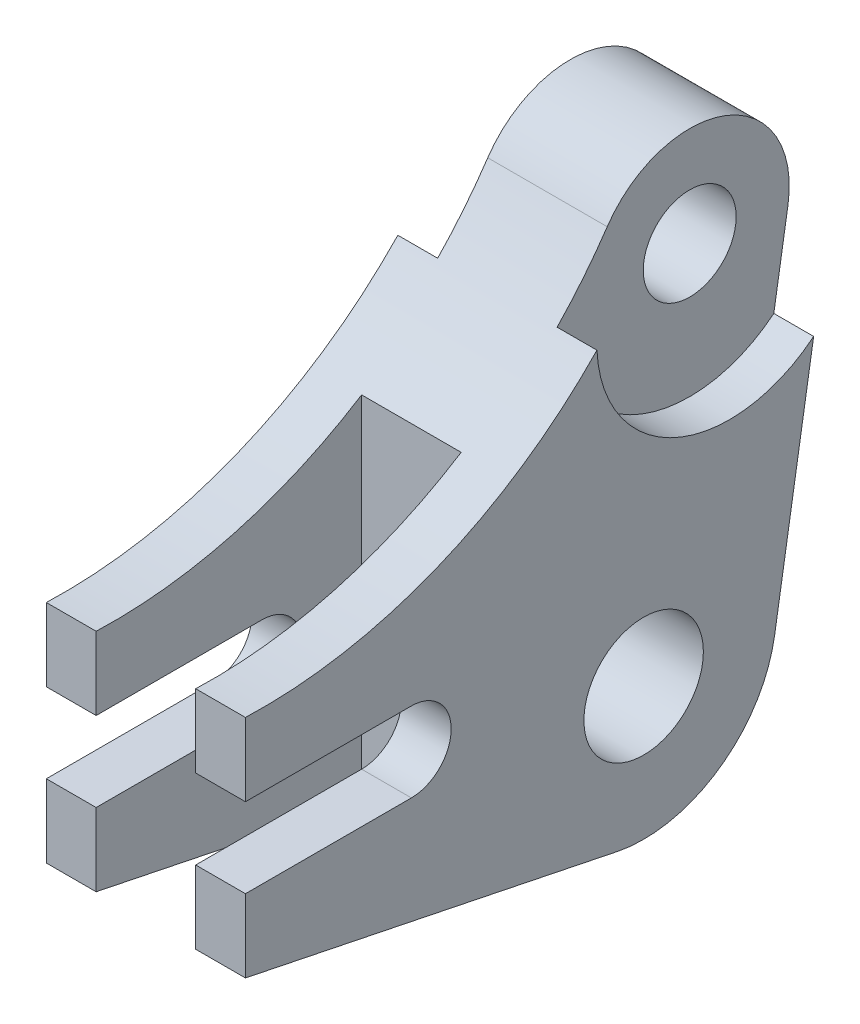
from build123d import *

# Parameters (mm, degrees)
IZIM2_R                     = 7
IZIM2_R_2                   = 9
Y_KSEKLIK_EKSTR_ZYON1_DEPTH = 15
IZIM3_R                     = 20
KES_EKSTR_ZYON1_DEPTH       = 6
KES_EKSTR_ZYON4_DEPTH       = 18
KES_EKSTR_ZYON4_DEPTH_BACK  = 77.999207989
IZIM5_W                     = 15
IZIM5_H                     = 40


with BuildPart() as part:
    # Çizim2 → Yükseklik-Ekstrüzyon1 (new, symmetric)
    with BuildSketch(Plane(origin=(0, 0, 0), x_dir=(0, 0, -1), z_dir=(1, 0, 0))):
        with BuildLine():
            Line((19.739319337, -3.218582315), (27.745441758, 45.882354578))
            ThreePointArc((27.745441758, 45.882354578), (18.474216993, 62.238421042), (0.510195975, 56.691307592))
            ThreePointArc((0.510195975, 56.691307592), (-25.763963339, 33.475550855), (-60, 25.912707322))
            Line((-60, 25.912707322), (-60, 14.912707322))
            Line((-60, 14.912707322), (-35, 14.912707322))
            ThreePointArc((-35, 14.912707322), (-29, 8.912707322), (-35, 2.912707322))
            Line((-35, 2.912707322), (-60, 2.912707322))
            Line((-60, 2.912707322), (-60, -8.087292678))
            Line((-60, -8.087292678), (-4.01109025, -19.593650885))
            ThreePointArc((-4.01109025, -19.593650885), (11.352533428, -16.465721508), (19.739319337, -3.218582315))
        make_face()
        with Locations((12.940952255, 48.296291314)):
            Circle(IZIM2_R, mode=Mode.SUBTRACT)
        Circle(IZIM2_R_2, mode=Mode.SUBTRACT)
    extrude(amount=Y_KSEKLIK_EKSTR_ZYON1_DEPTH, both=True)

    # Çizim3 → Kes-Ekstrüzyon1 (cut)
    with BuildSketch(Plane(origin=(15, 0, 0), x_dir=(0, 0, -1), z_dir=(1, 0, 0))):
        with Locations((12.940952255, 48.296291314)):
            Circle(IZIM3_R)
    kes_ekstr_zyon1 = extrude(amount=-KES_EKSTR_ZYON1_DEPTH, mode=Mode.SUBTRACT)

    # Aynalama1: Kes-Ekstrüzyon1 across plane
    add(kes_ekstr_zyon1.mirror(Plane(origin=(0, 0, 0), x_dir=(0, 0, 1), z_dir=(1, 0, 0))), mode=Mode.SUBTRACT)

    # Çizim5 → Kes-Ekstrüzyon4 (cut, two sides: drawn at the far end of the back side and taken through both)
    with BuildSketch(Plane(origin=(0, 25.86805022, 0), x_dir=(1, 0, 0), z_dir=(0, 1, 0)).offset(-KES_EKSTR_ZYON4_DEPTH_BACK)):
        with Locations((0.003643514, -40)):
            Rectangle(IZIM5_W, IZIM5_H)
    extrude(amount=KES_EKSTR_ZYON4_DEPTH + KES_EKSTR_ZYON4_DEPTH_BACK, mode=Mode.SUBTRACT)


solid = part.part
